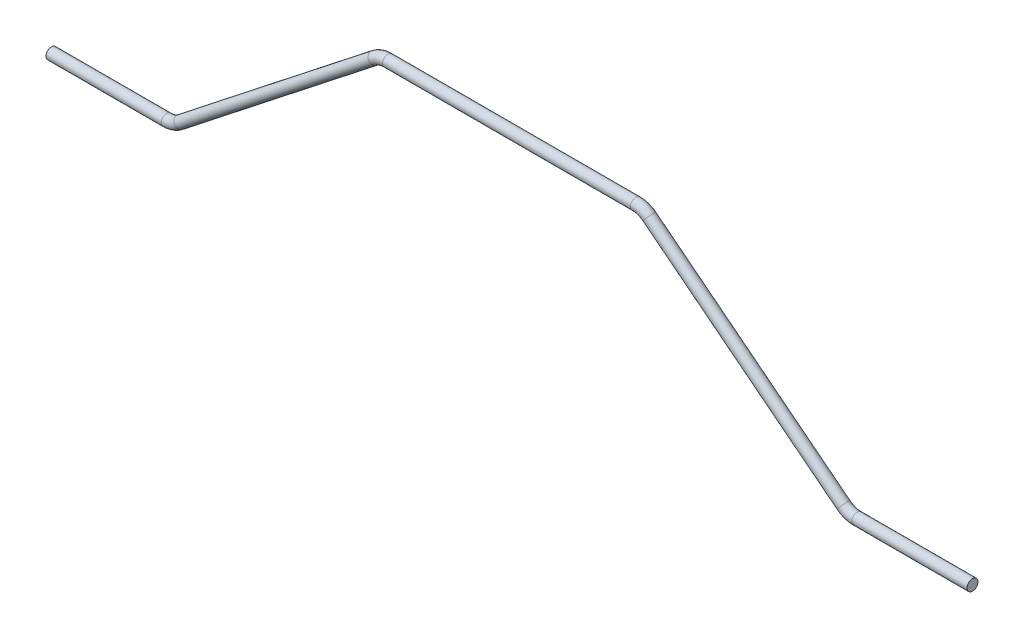
from build123d import *

# Parameters (mm, degrees)
SKETCH2_R = 2.5


with BuildPart() as part:
    # Sweep1: sweep along a path in Sketch1
    with BuildLine(Plane.XY) as sweep1_path:
        Line((210, -73.885714286), (157.459682683, -73.885714286))
        ThreePointArc((157.459682683, -73.885714286), (154.190143217, -73.336117012), (151.279989747, -71.747736622))
        Line((151.279989747, -71.747736622), (62.720010253, -2.137977664))
        ThreePointArc((62.720010253, -2.137977664), (59.809856783, -0.549597274), (56.540317317, 0))
        Line((56.540317317, 0), (-56.540317317, 0))
        ThreePointArc((-56.540317317, 0), (-59.809856783, -0.549597274), (-62.720010253, -2.137977664))
        Line((-62.720010253, -2.137977664), (-151.279989747, -71.747736622))
        ThreePointArc((-151.279989747, -71.747736622), (-154.190143217, -73.336117012), (-157.459682683, -73.885714286))
        Line((-157.459682683, -73.885714286), (-210, -73.885714286))
    # Sketch2 → Sweep1 (sweep)
    with BuildSketch(Plane(origin=(210, -73.885714286, 0), x_dir=(0, 0, -1), z_dir=(1, 0, 0))):
        with Locations((0, -0.042530313)):
            Circle(SKETCH2_R)
    sweep(path=sweep1_path.line)


solid = part.part
